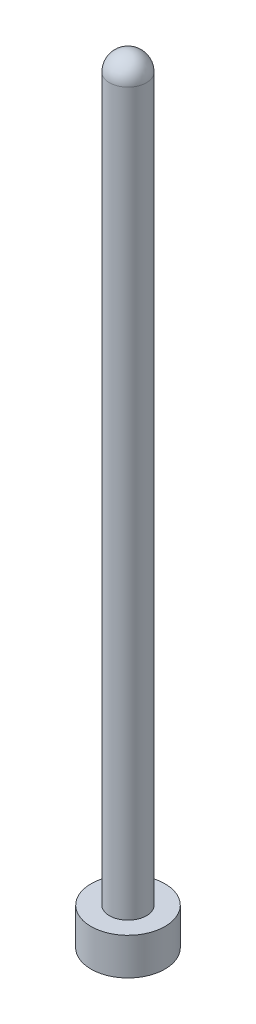
from build123d import *

# Parameters (mm, degrees)
SKETCH1_R           = 2.54
BOSS_EXTRUDE1_DEPTH = 2.54
SKETCH2_R           = 1.27
BOSS_EXTRUDE2_DEPTH = 50.8
FILLET7_R           = 1.27
SKETCH3_R           = 1.27
CUT_EXTRUDE1_DEPTH  = 1.27


with BuildPart() as part:
    # Sketch1 → Boss-Extrude1 (new body)
    with BuildSketch(Plane(origin=(0, 0, 0), x_dir=(1, 0, 0), z_dir=(0, 1, 0))):
        with Locations(Location((0, 0, 0), (0, 0, 270))):
            Circle(SKETCH1_R)
    extrude(amount=BOSS_EXTRUDE1_DEPTH)

    # Sketch2 → Boss-Extrude2 (add)
    with BuildSketch(Plane(origin=(0, 2.54, 0), x_dir=(1, 0, 0), z_dir=(0, 1, 0))):
        with Locations(Location((0, 0, 0), (0, 0, 270))):
            Circle(SKETCH2_R)
    extrude(amount=BOSS_EXTRUDE2_DEPTH)

    # Fillet7
    fillet7_edges = [part.edges().sort_by_distance(p)[0] for p in [
        (0, 53.34, -1.27),
    ]]
    fillet(fillet7_edges, radius=FILLET7_R)

    # Sketch3 → Cut-Extrude1 (cut)
    with BuildSketch(Plane.XZ):
        with Locations(Location((0, 0, 0), (0, 0, 270))):
            Circle(SKETCH3_R)
    extrude(amount=-CUT_EXTRUDE1_DEPTH, mode=Mode.SUBTRACT)


solid = part.part
